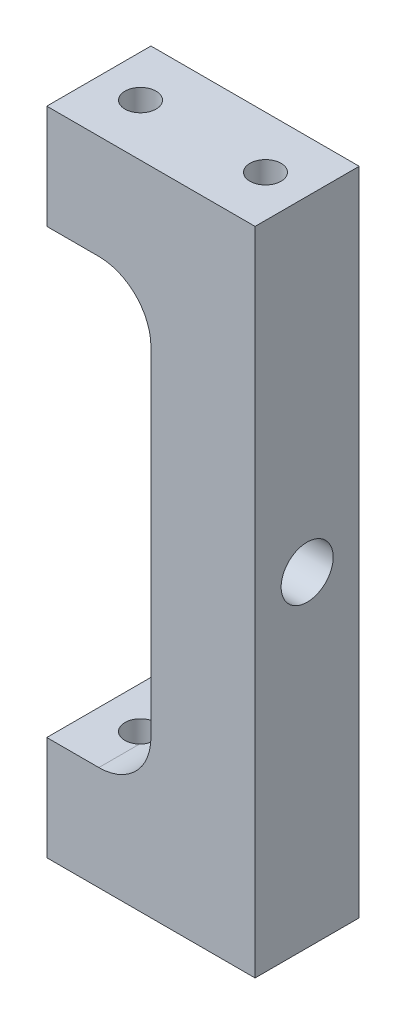
from build123d import *

# Parameters (mm, degrees)
SKETCH1_W                          = 25.4
SKETCH1_H                          = 12.7
STOCK_DEPTH                        = 79.375
SKETCH2_W                          = 12.7
SKETCH2_H                          = 53.975
CUTOUT_DEPTH                       = 85.302079601
FILLET1_R                          = 6.35
F_1_4_0_25_DIAMETER_HOLE1_D        = 6.35
MOUNTING_HOLES_ONE_SIDE_AT_2_COUNT = 2
MOUNTING_HOLES_ONE_SIDE_AT_2_PITCH = 15.24


with BuildPart() as part:
    # Sketch1 → Stock (new body)
    with BuildSketch(Plane(origin=(0, 0, 0), x_dir=(1, 0, 0), z_dir=(0, 1, 0))):
        with Locations((12.7, 6.35)):
            Rectangle(SKETCH1_W, SKETCH1_H)
    extrude(amount=STOCK_DEPTH)

    # Sketch2 → Cutout (cut, through all)
    with BuildSketch(Plane.XY):
        with Locations((6.35, 39.6875)):
            Rectangle(SKETCH2_W, SKETCH2_H)
    extrude(amount=-CUTOUT_DEPTH, mode=Mode.SUBTRACT)

    # Fillet1
    fillet1_edges = [part.edges().sort_by_distance(p)[0] for p in [
        (12.7, 66.675, -6.35),
        (12.7, 12.7, -6.35),
    ]]
    fillet(fillet1_edges, radius=FILLET1_R)

    # 1/4 (0.25) Diameter Hole1 (through all)
    with Locations(Plane.ZY.offset(-12.7)):
        with Locations((-6.35, 39.6875)):
            Hole(F_1_4_0_25_DIAMETER_HOLE1_D / 2)

    # Sketch8 → Mounting Holes One Side (revolve, cut)
    with BuildSketch(Plane(origin=(5.08, 79.375, -6.35), x_dir=(0, 0, 1), z_dir=(1, 0, 0))):
        Polygon((0, 0), (0, 13.840824014), (1.89865, 12.7), (1.89865, 0), align=None)
    mounting_holes_one_side = revolve(axis=Axis((5.08, 85.725, -6.35), (0, -1, 0)), mode=Mode.SUBTRACT)

    # Mounting Holes One Side at 2: Mounting Holes One Side ×2
    with Locations(*[(i * MOUNTING_HOLES_ONE_SIDE_AT_2_PITCH, 0, 0) for i in range(1, MOUNTING_HOLES_ONE_SIDE_AT_2_COUNT)]):
        add(mounting_holes_one_side, mode=Mode.SUBTRACT)

    # Mounting Holes: Mounting Holes One Side across plane
    add(mounting_holes_one_side.mirror(Plane(origin=(0, 39.6875, 0), x_dir=(0, 0, 1), z_dir=(0, -1, 0))), mode=Mode.SUBTRACT)

    # Mounting Holes copy 1 sketch → Mounting Holes copy 1 (revolve, cut)
    with BuildSketch(Plane(origin=(20.32, 0, -6.35), x_dir=(0, 0, 1), z_dir=(1, 0, 0))):
        Polygon((0, 0), (0, -13.840824014), (1.89865, -12.7), (1.89865, 0), align=None)
    revolve(axis=Axis((20.32, -6.35, -6.35), (0, -1, 0)), mode=Mode.SUBTRACT)


solid = part.part
